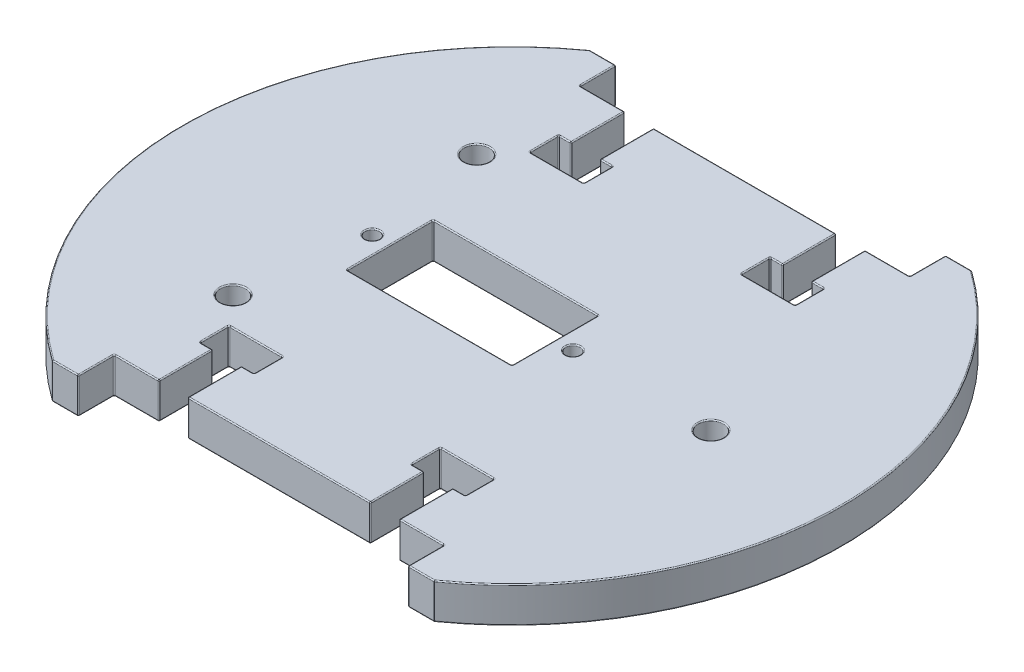
from build123d import *

# Parameters (mm, degrees)
SKETCH1_R           = 1
SKETCH1_R_2         = 1.75
SKETCH1_W           = 23
SKETCH1_H           = 12
BOSS_EXTRUDE1_DEPTH = 5
SKETCH5_W           = 4
SKETCH5_H           = 7.5
SKETCH5_W_2         = 7.5
SKETCH5_H_2         = 4
CUT_EXTRUDE1_DEPTH  = 60.558794481
FILLET1_R           = 0.15


with BuildPart() as part:
    # Sketch1 → Boss-Extrude1 (new body)
    with BuildSketch(Plane(origin=(0, 0, 0), x_dir=(1, 0, 0), z_dir=(0, 1, 0))):
        with BuildLine():
            Line((-26.64113361, 37.5), (-23, 37.5))
            Line((-23, 37.5), (-23, 32.5))
            Line((-23, 32.5), (23, 32.5))
            Line((23, 32.5), (23, 37.5))
            Line((23, 37.5), (26.64113361, 37.5))
            ThreePointArc((26.64113361, 37.5), (46, 0), (26.64113361, -37.5))
            Line((26.64113361, -37.5), (23, -37.5))
            Line((23, -37.5), (23, -32.5))
            Line((23, -32.5), (-23, -32.5))
            Line((-23, -32.5), (-23, -37.5))
            Line((-23, -37.5), (-26.64113361, -37.5))
            ThreePointArc((-26.64113361, -37.5), (-46, 0), (-26.64113361, 37.5))
        make_face()
        with Locations(Location((-19.5, 0, 0), (0, 0, 270))):
            Circle(SKETCH1_R, mode=Mode.SUBTRACT)
        with Locations(Location((8.5, 0, 0), (0, 0, 270))):
            Circle(SKETCH1_R, mode=Mode.SUBTRACT)
        with Locations(Location((-21.93, 17, 0), (0, 0, 270))):
            Circle(SKETCH1_R_2, mode=Mode.SUBTRACT)
        with Locations(Location((-21.93, -17, 0), (0, 0, 270))):
            Circle(SKETCH1_R_2, mode=Mode.SUBTRACT)
        with Locations(Location((27.75, 0, 0), (0, 0, 270))):
            Circle(SKETCH1_R_2, mode=Mode.SUBTRACT)
        with Locations((-5.5, 0)):
            Rectangle(SKETCH1_W, SKETCH1_H, mode=Mode.SUBTRACT)
    extrude(amount=BOSS_EXTRUDE1_DEPTH)

    # Sketch5 → Cut-Extrude1 (cut, through all)
    with BuildSketch(Plane(origin=(0, 5, 0), x_dir=(1, 0, 0), z_dir=(0, 1, 0))):
        with Locations((-14.75, 28.75)):
            Rectangle(SKETCH5_W, SKETCH5_H)
        with Locations((-14.75, 23)):
            Rectangle(SKETCH5_W_2, SKETCH5_H_2)
        with Locations((14.75, 23)):
            Rectangle(SKETCH5_W_2, SKETCH5_H_2)
        with Locations((14.75, 28.75)):
            Rectangle(SKETCH5_W, SKETCH5_H)
        with Locations((14.75, -28.75)):
            Rectangle(SKETCH5_W, SKETCH5_H)
        with Locations((14.75, -23)):
            Rectangle(SKETCH5_W_2, SKETCH5_H_2)
        with Locations((-14.75, -23)):
            Rectangle(SKETCH5_W_2, SKETCH5_H_2)
        with Locations((-14.75, -28.75)):
            Rectangle(SKETCH5_W, SKETCH5_H)
    extrude(amount=-CUT_EXTRUDE1_DEPTH, mode=Mode.SUBTRACT)

    # Fillet1
    fillet1_edges = [part.edges().sort_by_distance(p)[0] for p in [
        (-14.75, 5, 21),
        (-18.5, 2.5, 21),
        (-11, 5, 23),
        (-11, 2.5, 21),
        (-18.5, 0, 23),
        (-18.5, 2.5, 25),
        (-18.5, 5, 23),
        (-17.625, 5, 25),
        (-16.75, 5, 28.75),
        (-11.875, 5, 25),
        (-14.75, 0, 21),
        (-11, 0, 23),
        (-12.75, 0, 28.75),
        (-17.625, 0, 25),
        (-16.75, 2.5, 25),
        (-11.875, 0, 25),
        (-11, 2.5, 25),
        (-12.75, 2.5, 32.5),
        (-16.75, 0, 28.75),
        (-16.75, 2.5, 32.5),
        (-12.75, 5, 28.75),
        (-12.75, 2.5, 25),
        (12.75, 5, -28.75),
        (12.75, 2.5, -25),
        (12.75, 2.5, -32.5),
        (16.75, 0, -28.75),
        (16.75, 2.5, -32.5),
        (14.75, 0, -21),
        (11, 0, -23),
        (12.75, 0, -28.75),
        (11.875, 5, -25),
        (18.5, 5, -23),
        (17.625, 5, -25),
        (16.75, 5, -28.75),
        (-24.820566805, 0, -37.5),
        (14.75, 5, -21),
        (18.5, 2.5, -21),
        (11, 5, -23),
        (11, 2.5, -21),
        (18.5, 0, -23),
        (18.5, 2.5, -25),
        (17.625, 0, -25),
        (16.75, 2.5, -25),
        (11.875, 0, -25),
        (11, 2.5, -25),
        (-23, 0, -35),
        (-23, 5, 35),
        (19.875, 0, -32.5),
        (-16.75, 5, -28.75),
        (-16.75, 2.5, -25),
        (-16.75, 2.5, -32.5),
        (-12.75, 0, -28.75),
        (-12.75, 2.5, -32.5),
        (-11.875, 0, -25),
        (-18.5, 0, -23),
        (-17.625, 0, -25),
        (-16.75, 0, -28.75),
        (-14.75, 5, -21),
        (-11, 5, -23),
        (-12.75, 5, -28.75),
        (-14.75, 0, -21),
        (-11, 2.5, -21),
        (23, 0, -35),
        (-18.5, 5, -23),
        (-18.5, 2.5, -21),
        (-11, 0, -23),
        (-11, 2.5, -25),
        (-12.75, 2.5, -25),
        (-11.875, 5, -25),
        (-18.5, 2.5, -25),
        (-17.625, 5, -25),
        (24.820566805, 0, -37.5),
        (14.75, 0, 21),
        (11, 2.5, 21),
        (18.5, 5, 23),
        (18.5, 2.5, 21),
        (11, 0, 23),
        (46, 0, 0),
        (11, 2.5, 25),
        (14.75, 5, 21),
        (11, 5, 23),
        (12.75, 5, 28.75),
        (18.5, 0, 23),
        (17.625, 0, 25),
        (16.75, 0, 28.75),
        (11.875, 0, 25),
        (12.75, 2.5, 25),
        (11.875, 5, 25),
        (18.5, 2.5, 25),
        (17.625, 5, 25),
        (16.75, 2.5, 32.5),
        (12.75, 0, 28.75),
        (24.820566805, 0, 37.5),
        (12.75, 2.5, 32.5),
        (16.75, 5, 28.75),
        (16.75, 2.5, 25),
        (23, 0, 35),
        (-19.875, 0, 32.5),
        (-23, 0, 35),
        (-24.820566805, 0, 37.5),
        (-46, 0, 0),
        (-19.875, 5, 32.5),
        (-26.64113361, 2.5, -37.5),
        (-23, 2.5, -37.5),
        (-23, 2.5, -32.5),
        (23, 5, 35),
        (23, 2.5, -32.5),
        (23, 2.5, -37.5),
        (26.64113361, 2.5, -37.5),
        (26.64113361, 2.5, 37.5),
        (23, 2.5, 37.5),
        (23, 2.5, 32.5),
        (-23, 2.5, 32.5),
        (-23, 2.5, 37.5),
        (-26.64113361, 2.5, 37.5),
        (24.820566805, 5, 37.5),
        (46, 5, 0),
        (24.820566805, 5, -37.5),
        (6, 0, 0),
        (6, 2.5, 6),
        (-5.5, 0, -6),
        (6, 2.5, -6),
        (-17, 0, 0),
        (-17, 2.5, -6),
        (-5.5, 0, 6),
        (-17, 2.5, 6),
        (6, 5, 0),
        (-5.5, 5, -6),
        (-17, 5, 0),
        (-5.5, 5, 6),
        (23, 5, -35),
        (19.875, 5, -32.5),
        (-19.5, 0, -1),
        (-19.5, 5, -1),
        (-23, 5, -35),
        (8.5, 0, -1),
        (8.5, 5, -1),
        (-24.820566805, 5, -37.5),
        (-46, 5, 0),
        (-21.93, 0, -18.75),
        (-21.93, 5, -18.75),
        (-21.93, 0, 15.25),
        (-21.93, 5, 15.25),
        (27.75, 0, -1.75),
        (27.75, 5, -1.75),
        (0, 0, -32.5),
        (-19.875, 0, -32.5),
        (0, 5, -32.5),
        (-19.875, 5, -32.5),
        (0, 0, 32.5),
        (19.875, 0, 32.5),
        (0, 5, 32.5),
        (19.875, 5, 32.5),
        (-24.820566805, 5, 37.5),
    ]]
    fillet(fillet1_edges, radius=FILLET1_R)


solid = part.part
